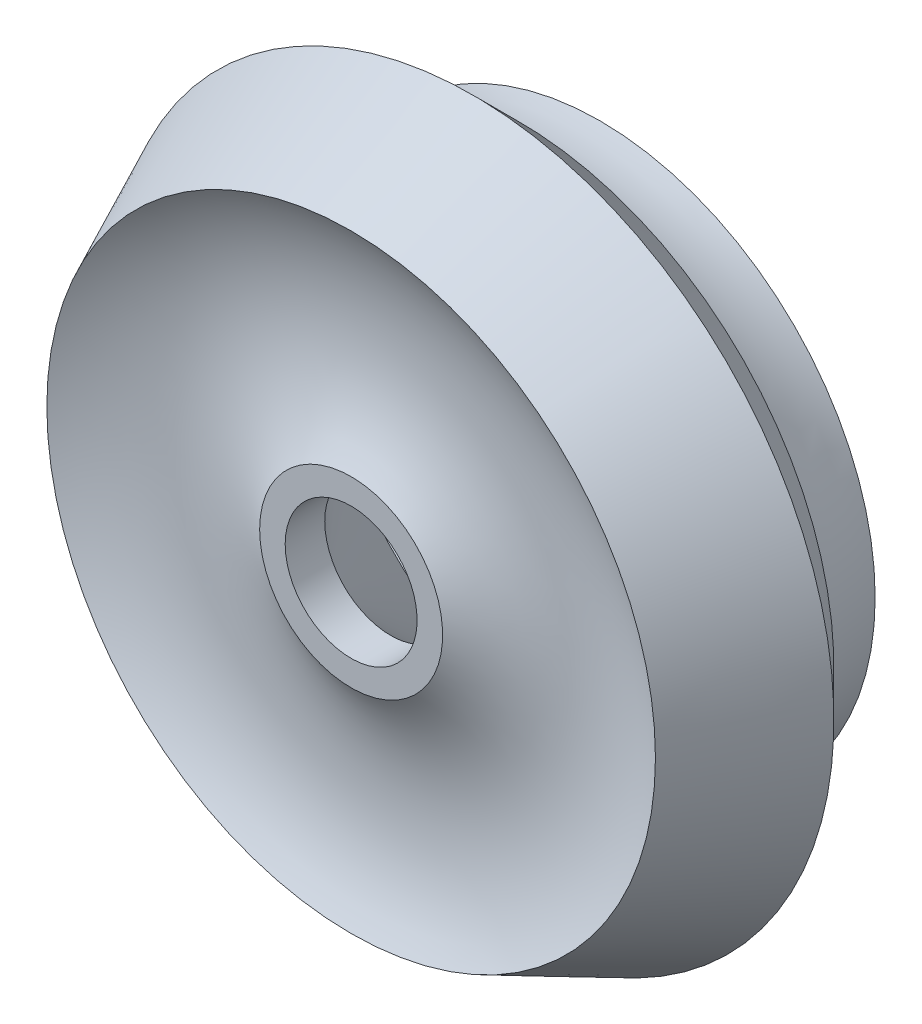
from build123d import *


with BuildPart() as part:
    # Hatch Sketch → Hatch Revolution (revolve)
    with BuildSketch(Plane(origin=(0, 0, 0), x_dir=(0, 0, -1), z_dir=(1, 0, 0)), mode=Mode.PRIVATE) as hatch_revolution_sk:
        with BuildLine():
            Line((587.274308735, 273.648124971), (495, 230.651707126))
            ThreePointArc((495, 230.651707126), (518.527464888, 150), (495, 69.348292874))
            Line((495, 69.348292874), (495, 50))
            Line((495, 50), (525, 50))
            Line((525, 50), (658.847763109, 183.847763109))
            ThreePointArc((658.847763109, 183.847763109), (671.744192687, 169.975653092), (683.59650045, 155.201481952))
            Line((683.59650045, 155.201481952), (683.59650045, 208.59650045))
            ThreePointArc((683.59650045, 208.59650045), (643.910388309, 209.909991295), (606.825613004, 224.102672354))
            Line((606.825613004, 224.102672354), (621.822687178, 239.099746528))
            Line((621.822687178, 239.099746528), (587.274308735, 273.648124971))
        make_face()
    revolve(hatch_revolution_sk.sketch.rotate(Axis((0, 0, -546.1), (0, 0, 1)), 90), axis=Axis((0, 0, -546.1), (0, 0, 1)))


solid = part.part
